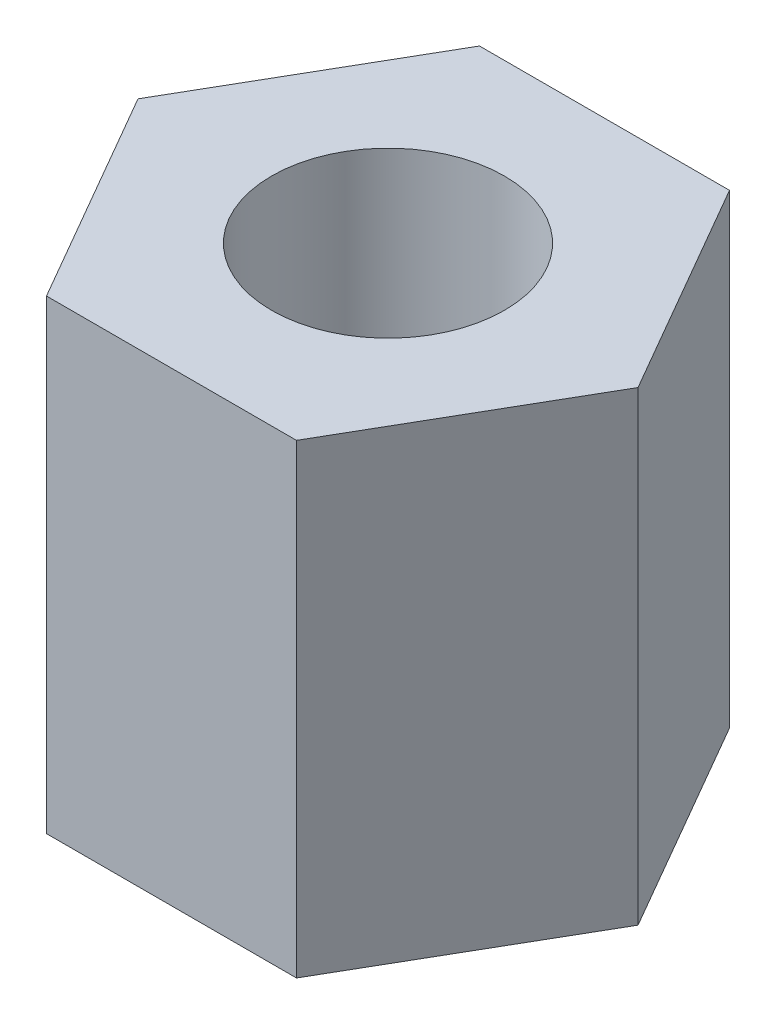
from build123d import *

# Parameters (mm, degrees)
EXTRUDE_1_DEPTH = 2.5


with BuildPart() as part:
    # 草图1 → 凸台-拉伸1 (new, symmetric)
    with BuildSketch(Plane(origin=(0, 0, 0), x_dir=(1, 0, 0), z_dir=(0, 1, 0))):
        Polygon((2.684678752, 0), (1.342339376, 2.325), (-1.342339376, 2.325), (-2.684678752, 0), (-1.342339376, -2.325), (1.342339376, -2.325), align=None)
    extrude(amount=EXTRUDE_1_DEPTH, both=True)

    # 草图2 → M3 螺纹孔1 (revolve, cut)
    with BuildSketch(Plane(origin=(0, -2.5, 0), x_dir=(0, 0, -1), z_dir=(1, 0, 0))):
        Polygon((0, 0), (0, 8.251075774), (1.25, 7.5), (1.25, 0), align=None)
    hole_wizard_m3_1 = revolve(axis=Axis((0, -8.85, 0), (0, 1, 0)), mode=Mode.SUBTRACT)

    # 镜向1: M3 螺纹孔1 across plane
    add(hole_wizard_m3_1.mirror(Plane.ZX), mode=Mode.SUBTRACT)


solid = part.part
